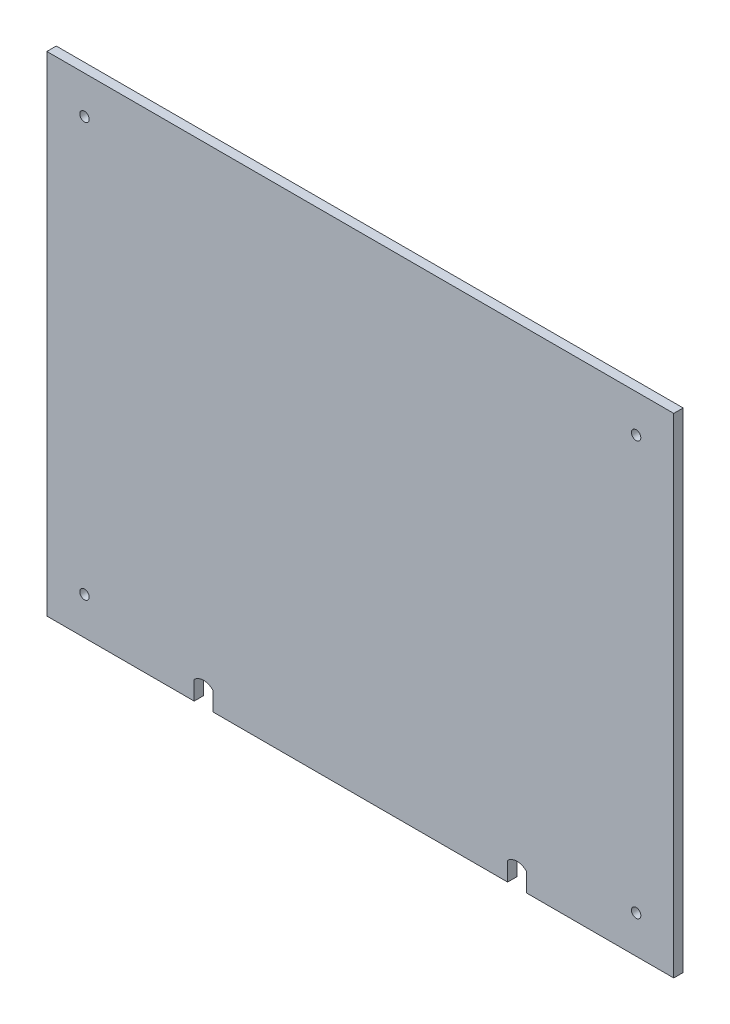
from build123d import *

# Parameters (mm, degrees)
SKETCH1_W           = 200
SKETCH1_H           = 156
BOSS_EXTRUDE1_DEPTH = 3
SKETCH2_R           = 1.5
CUT_EXTRUDE1_DEPTH  = 17
CUT_EXTRUDE10_DEPTH = 10


with BuildPart() as part:
    # Sketch1 → Boss-Extrude1 (new body)
    with BuildSketch(Plane.XY):
        with Locations((100, 78)):
            Rectangle(SKETCH1_W, SKETCH1_H)
    extrude(amount=BOSS_EXTRUDE1_DEPTH)

    # Sketch2 → Cut-Extrude1 (cut)
    with BuildSketch(Plane.XY.offset(3)):
        with Locations((12, 12)):
            Circle(SKETCH2_R)
        with Locations((12, 144)):
            Circle(SKETCH2_R)
        with Locations((188, 144)):
            Circle(SKETCH2_R)
        with Locations((188, 12)):
            Circle(SKETCH2_R)
    extrude(amount=-CUT_EXTRUDE1_DEPTH, mode=Mode.SUBTRACT)

    # Sketch6 → Cut-Extrude10 (cut)
    with BuildSketch(Plane.XY.offset(3)):
        with BuildLine():
            Line((153, 0), (147, 0))
            Line((147, 0), (147, 6))
            ThreePointArc((147, 6), (150, 7.242640687), (153, 6))
            Line((153, 6), (153, 0))
        make_face()
        with BuildLine():
            Line((53, 0), (53, 6))
            ThreePointArc((53, 6), (50, 7.242640687), (47, 6))
            Line((47, 6), (47, 0))
            Line((47, 0), (53, 0))
        make_face()
    extrude(amount=-CUT_EXTRUDE10_DEPTH, mode=Mode.SUBTRACT)


solid = part.part
